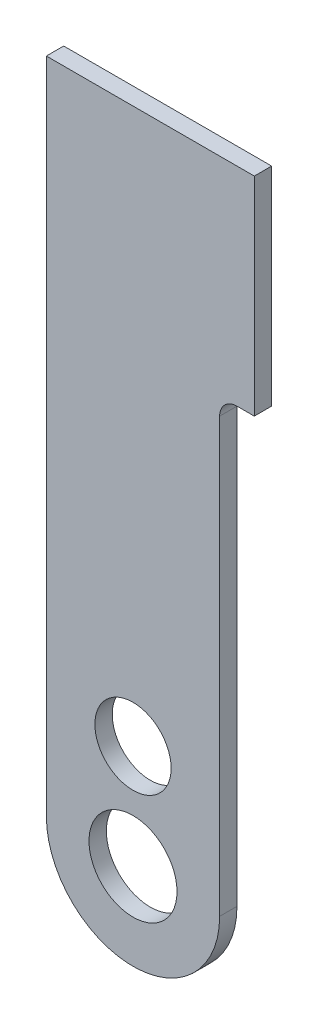
from build123d import *

# Parameters (mm, degrees)
SKETCH1_R               = 25
BOSS_EXTRUDE1_DEPTH     = 2.5
SKETCH3_W               = 50
SKETCH3_H               = 190
BOSS_EXTRUDE2_DEPTH     = 2.5
SKETCH4_W               = 10
SKETCH4_H               = 60
BOSS_EXTRUDE3_DEPTH     = 2.5
CUT_EXTRUDE2_DEPTH      = 164.802472509
CUT_EXTRUDE2_DEPTH_BACK = 164.802472509
SKETCH7_R               = 11
SKETCH7_R_2             = 12.7
FILLET1_R               = 5


with BuildPart() as part:
    # Sketch1 → Boss-Extrude1 (new, symmetric)
    with BuildSketch(Plane.XY):
        with Locations((0, -30)):
            Circle(SKETCH1_R)
    extrude(amount=BOSS_EXTRUDE1_DEPTH, both=True)

    # Sketch3 → Boss-Extrude2 (add, symmetric)
    with BuildSketch(Plane.XY):
        with Locations((0, 65)):
            Rectangle(SKETCH3_W, SKETCH3_H)
    extrude(amount=BOSS_EXTRUDE2_DEPTH, both=True)

    # Sketch4 → Boss-Extrude3 (add, symmetric)
    with BuildSketch(Plane.XY):
        with Locations((30, 130)):
            Rectangle(SKETCH4_W, SKETCH4_H)
    extrude(amount=BOSS_EXTRUDE3_DEPTH, both=True)

    # Sketch7 → Cut-Extrude2 (cut, two sides: drawn at the far end of the back side and taken through both)
    with BuildSketch(Plane.XY.offset(-CUT_EXTRUDE2_DEPTH_BACK)):
        Circle(SKETCH7_R)
        with Locations((0, -30)):
            Circle(SKETCH7_R_2)
    extrude(amount=CUT_EXTRUDE2_DEPTH + CUT_EXTRUDE2_DEPTH_BACK, mode=Mode.SUBTRACT)

    # Fillet1
    fillet1_edges = [part.edges().sort_by_distance(p)[0] for p in [
        (25, 100, 0),
    ]]
    fillet(fillet1_edges, radius=FILLET1_R)


solid = part.part
